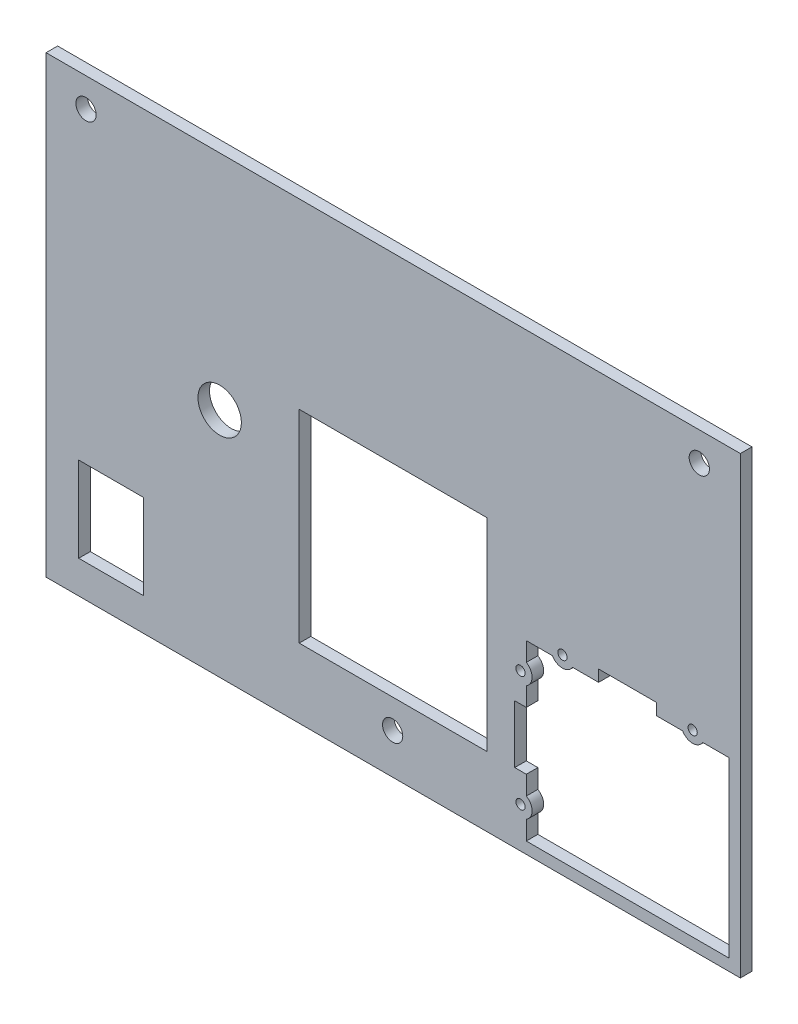
from build123d import *

# Parameters (mm, degrees)
SKETCH1_W           = 240
SKETCH1_H           = 157
BOSS_EXTRUDE1_DEPTH = 4
SKETCH2_R           = 3.5
CUT_EXTRUDE1_DEPTH  = 144.451211218
CUT_EXTRUDE2_DEPTH  = 4
SKETCH4_R           = 1.6
BOSS_EXTRUDE2_DEPTH = 4
SKETCH4_2_R         = 1.6
CUT_EXTRUDE3_DEPTH  = 4
SKETCH5_R           = 1.6
CUT_EXTRUDE5_DEPTH  = 4
BOSS_EXTRUDE4_DEPTH = 4
SKETCH6_R           = 7.5
CUT_EXTRUDE6_DEPTH  = 144.451211218
SKETCH7_W           = 65
SKETCH7_H           = 70
CUT_EXTRUDE7_DEPTH  = 144.451211218
SKETCH8_W           = 22.4
SKETCH8_H           = 29.4
CUT_EXTRUDE8_DEPTH  = 144.451211218


with BuildPart() as part:
    # Sketch1 → Boss-Extrude1 (new body)
    with BuildSketch(Plane.XY):
        Rectangle(SKETCH1_W, SKETCH1_H)
    extrude(amount=BOSS_EXTRUDE1_DEPTH)

    # Sketch2 → Cut-Extrude1 (cut, through all)
    with BuildSketch(Plane.XY.offset(4)):
        with Locations((-106.199999998, 68.5)):
            Circle(SKETCH2_R)
        with Locations((105.8, 68.5)):
            Circle(SKETCH2_R)
        with Locations((-0.199999998, -64.5)):
            Circle(SKETCH2_R)
    extrude(amount=-CUT_EXTRUDE1_DEPTH, mode=Mode.SUBTRACT)

    # Sketch3 → Cut-Extrude2 (cut)
    with BuildSketch(Plane(origin=(0, 0, 0), x_dir=(-1, 0, 0), z_dir=(0, 0, -1))):
        Polygon((-46, -74.5), (-116, -74.5), (-116, -14.5), (-91, -14.5), (-91, -10.5), (-71, -10.5), (-71, -14.5), (-46, -14.5), (-46, -34.5), (-42, -34.5), (-42, -54.5), (-46, -54.5), align=None)
    extrude(amount=-CUT_EXTRUDE2_DEPTH, mode=Mode.SUBTRACT)

    # Sketch4 → Boss-Extrude2 (add)
    with BuildSketch(Plane.XY.offset(4)):
        with Locations((44, -24.5)):
            Circle(SKETCH4_R)
        with BuildLine():
            Line((46, -21.035898385), (46, -27.964101615))
            ThreePointArc((46, -27.964101615), (48, -24.5), (46, -21.035898385))
        make_face()
    boss_extrude2 = extrude(amount=-BOSS_EXTRUDE2_DEPTH)

    # Sketch4<2> → Cut-Extrude3 (cut)
    with BuildSketch(Plane.XY.offset(4)):
        with Locations((44, -24.5)):
            Circle(SKETCH4_2_R)
    cut_extrude3 = extrude(amount=-CUT_EXTRUDE3_DEPTH, mode=Mode.SUBTRACT)

    # Mirror1: Boss-Extrude2, Cut-Extrude3 across plane
    add(boss_extrude2.mirror(Plane(origin=(0, -44.5, 0), x_dir=(0, 0, 1), z_dir=(0, -1, 0))))
    add(cut_extrude3.mirror(Plane(origin=(0, -44.5, 0), x_dir=(0, 0, 1), z_dir=(0, -1, 0))), mode=Mode.SUBTRACT)

    # Sketch5 → Cut-Extrude5 (cut)
    with BuildSketch(Plane.XY.offset(4)):
        with Locations((58.5, -12.5)):
            Circle(SKETCH5_R)
    cut_extrude5 = extrude(amount=-CUT_EXTRUDE5_DEPTH, mode=Mode.SUBTRACT)

    # Sketch5<5> → Boss-Extrude4 (add)
    with BuildSketch(Plane.XY.offset(4)):
        with BuildLine():
            Line((61.964101615, -14.5), (55.035898385, -14.5))
            ThreePointArc((55.035898385, -14.5), (58.5, -16.5), (61.964101615, -14.5))
        make_face()
    boss_extrude4 = extrude(amount=-BOSS_EXTRUDE4_DEPTH)

    # Mirror3: Cut-Extrude5, Boss-Extrude4 across plane
    add(cut_extrude5.mirror(Plane(origin=(81, 0, 0), x_dir=(0, 0, 1), z_dir=(1, 0, 0))), mode=Mode.SUBTRACT)
    add(boss_extrude4.mirror(Plane(origin=(81, 0, 0), x_dir=(0, 0, 1), z_dir=(1, 0, 0))))

    # Sketch6 → Cut-Extrude6 (cut, through all)
    with BuildSketch(Plane(origin=(0, 0, 0), x_dir=(-1, 0, 0), z_dir=(0, 0, -1))):
        with Locations((60, 1.5)):
            Circle(SKETCH6_R)
    extrude(amount=-CUT_EXTRUDE6_DEPTH, mode=Mode.SUBTRACT)

    # Sketch7 → Cut-Extrude7 (cut, through all)
    with BuildSketch(Plane.XY.offset(4)):
        with Locations((0, -19.5)):
            Rectangle(SKETCH7_W, SKETCH7_H)
    extrude(amount=-CUT_EXTRUDE7_DEPTH, mode=Mode.SUBTRACT)

    # Sketch8 → Cut-Extrude8 (cut, through all)
    with BuildSketch(Plane(origin=(0, 0, 0), x_dir=(-1, 0, 0), z_dir=(0, 0, -1))):
        with Locations((97.5, -52.5)):
            Rectangle(SKETCH8_W, SKETCH8_H)
    extrude(amount=-CUT_EXTRUDE8_DEPTH, mode=Mode.SUBTRACT)


solid = part.part
